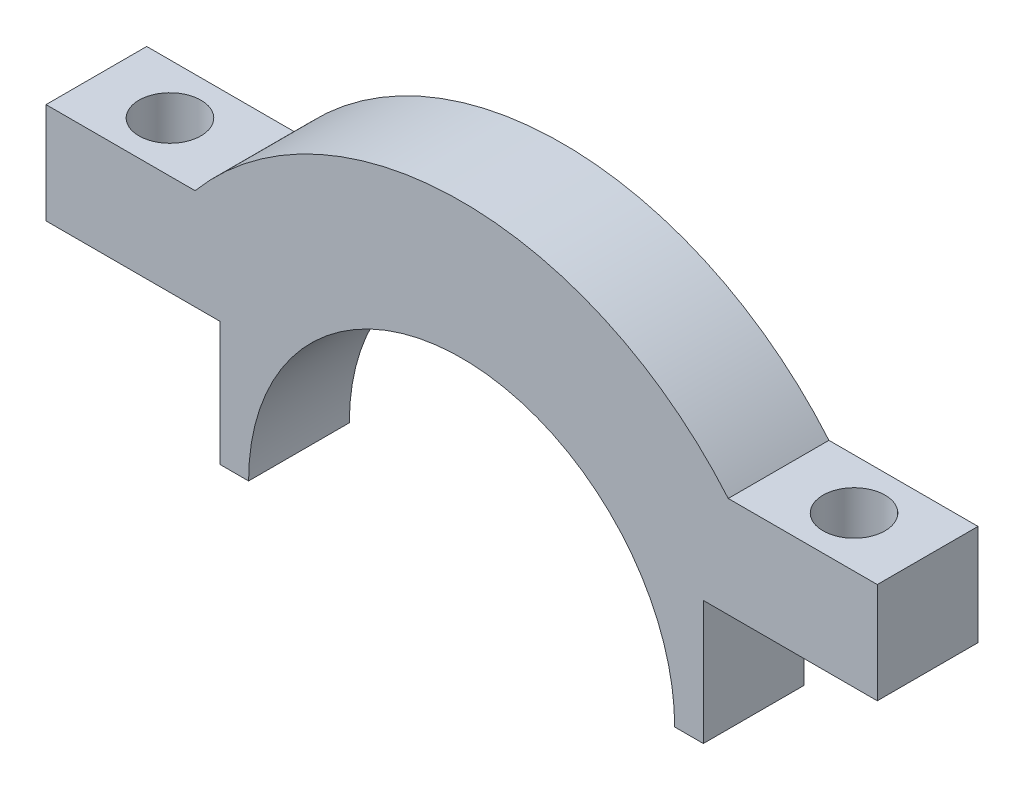
from build123d import *

# Parameters (mm, degrees)
BOSS_EXTRUDE1_DEPTH = 13
SKETCH3_R           = 4
CUT_EXTRUDE1_DEPTH  = 13


with BuildPart() as part:
    # Sketch1 → Boss-Extrude1 (new body)
    with BuildSketch(Plane.XY):
        with BuildLine():
            Line((-27.5, 0), (-31.2, 0))
            Line((-31.2, 0), (-31.2, 16))
            Line((-31.2, 16), (-53.65, 16))
            Line((-53.65, 16), (-53.65, 29))
            Line((-53.65, 29), (-34.409301068, 29))
            ThreePointArc((-34.409301068, 29), (0, 45), (34.409301068, 29))
            Line((34.409301068, 29), (53.65, 29))
            Line((53.65, 29), (53.65, 16))
            Line((53.65, 16), (31.2, 16))
            Line((31.2, 16), (31.2, 0))
            Line((31.2, 0), (27.5, 0))
            ThreePointArc((27.5, 0), (0, 27.5), (-27.5, 0))
        make_face()
    extrude(amount=-BOSS_EXTRUDE1_DEPTH)

    # Sketch3 → Cut-Extrude1 (cut)
    with BuildSketch(Plane(origin=(0, 29, 0), x_dir=(1, 0, 0), z_dir=(0, 1, 0))):
        with Locations(Location((-44.15, 6.5, 0), (0, 0, 180))):
            Circle(SKETCH3_R)
        with Locations((44.15, 6.5)):
            Circle(SKETCH3_R)
    extrude(amount=-CUT_EXTRUDE1_DEPTH, mode=Mode.SUBTRACT)


solid = part.part
